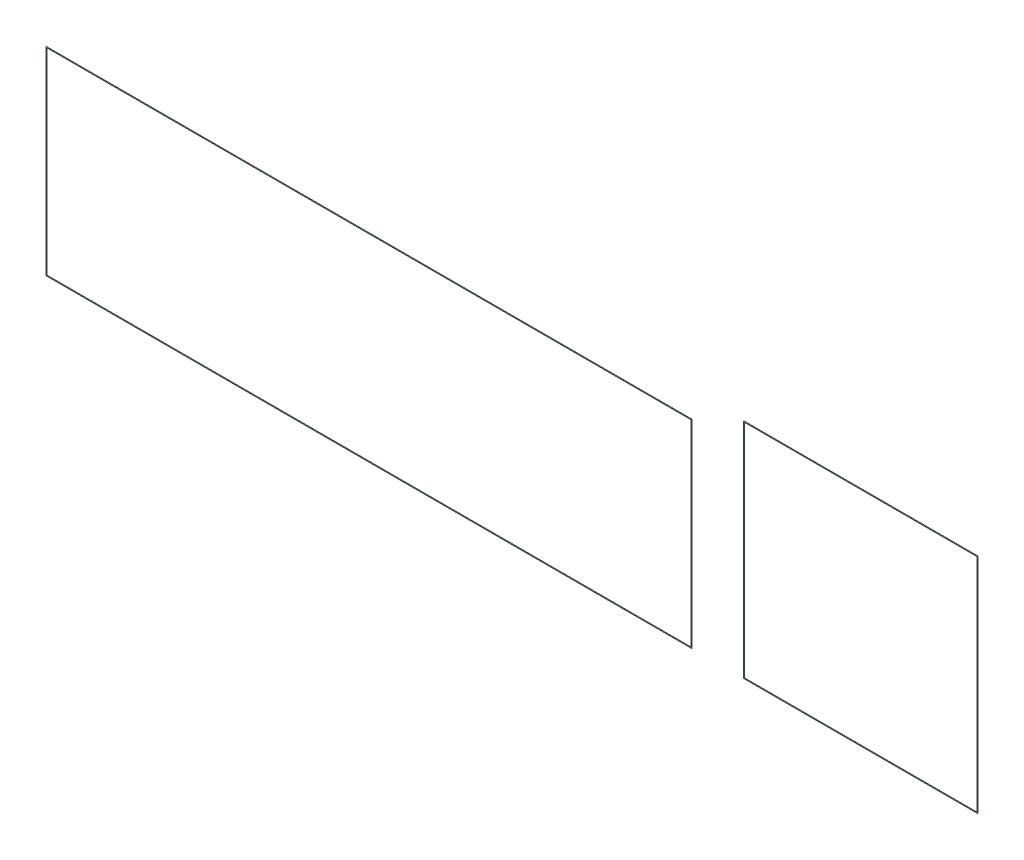
from build123d import *

# Parameters (mm, degrees)
CROQUIS1_W              = 62782.83
CROQUIS1_H              = 19320
CROQUIS1_W_2            = 62582.83
CROQUIS1_H_2            = 19120
SALIENTE_EXTRUIR1_DEPTH = 1
CROQUIS3_W              = 22800
CROQUIS3_H              = 21700
CROQUIS3_W_2            = 22600
CROQUIS3_H_2            = 21500
SALIENTE_EXTRUIR2_DEPTH = 1


with BuildPart() as part:
    # Croquis1 → Saliente-Extruir1 (new body)
    with BuildSketch(Plane.XY):
        Rectangle(CROQUIS1_W, CROQUIS1_H)
        Rectangle(CROQUIS1_W_2, CROQUIS1_H_2, mode=Mode.SUBTRACT)
    extrude(amount=SALIENTE_EXTRUIR1_DEPTH)


with BuildPart() as body_2:
    # Croquis3 → Saliente-Extruir2 (new body)
    with BuildSketch(Plane.XY):
        with Locations((47791.415, 1190)):
            Rectangle(CROQUIS3_W, CROQUIS3_H)
        with Locations((47791.415, 1190)):
            Rectangle(CROQUIS3_W_2, CROQUIS3_H_2, mode=Mode.SUBTRACT)
    extrude(amount=SALIENTE_EXTRUIR2_DEPTH)


solid = Compound([part.part, body_2.part])
